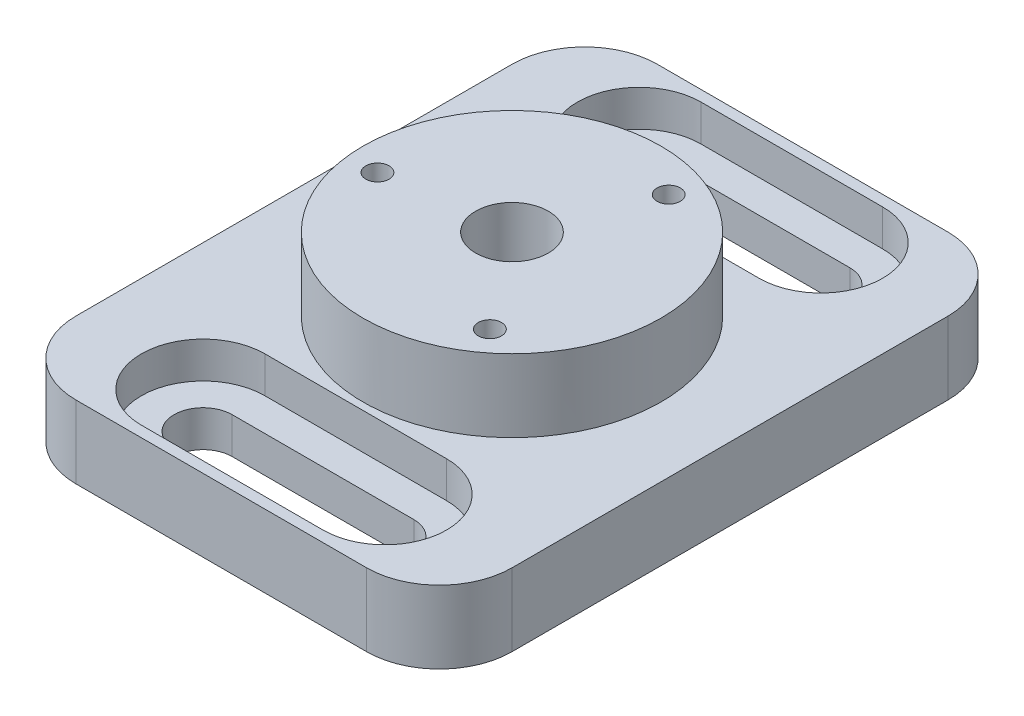
from build123d import *

# Parameters (mm, degrees)
SKETCH1_R           = 20.5
SKETCH1_R_2         = 1.6
SKETCH1_R_3         = 5
BOSS_EXTRUDE1_DEPTH = 20
SKETCH2_W           = 60
SKETCH2_H           = 80
SKETCH2_R           = 20.5
BOSS_EXTRUDE2_DEPTH = 10
CUT_EXTRUDE1_DEPTH  = 5
FILLET1_R           = 10
SKETCH4_R           = 5
CUT_EXTRUDE2_DEPTH  = 7


with BuildPart() as part:
    # Sketch1 → Boss-Extrude1 (new body)
    with BuildSketch(Plane(origin=(0, 0, 0), x_dir=(1, 0, 0), z_dir=(0, 1, 0))):
        with Locations(Location((0, 0, 0), (0, 0, 270))):
            Circle(SKETCH1_R)
        with Locations(Location((6.314276634, 15.244012286, 0), (0, 0, 270))):
            Circle(SKETCH1_R_2, mode=Mode.SUBTRACT)
        with Locations(Location((10.044563579, -13.090330115, 0), (0, 0, 270))):
            Circle(SKETCH1_R_2, mode=Mode.SUBTRACT)
        with Locations(Location((-16.358840213, -2.153682172, 0), (0, 0, 270))):
            Circle(SKETCH1_R_2, mode=Mode.SUBTRACT)
        with Locations(Location((0, 0, 0), (0, 0, 270))):
            Circle(SKETCH1_R_3, mode=Mode.SUBTRACT)
    extrude(amount=BOSS_EXTRUDE1_DEPTH)

    # Sketch2 → Boss-Extrude2 (add)
    with BuildSketch(Plane.XZ):
        Rectangle(SKETCH2_W, SKETCH2_H)
        with Locations(Location((0, 0, 0), (0, 0, 270))):
            Circle(SKETCH2_R, mode=Mode.SUBTRACT)
        with BuildLine():
            Line((-12.5, 34), (12.5, 34))
            ThreePointArc((12.5, 34), (16.5, 30), (12.5, 26))
            Line((12.5, 26), (-12.5, 26))
            ThreePointArc((-12.5, 26), (-16.5, 30), (-12.5, 34))
        make_face(mode=Mode.SUBTRACT)
        with BuildLine():
            Line((-12.5, -34), (12.5, -34))
            ThreePointArc((12.5, -34), (16.5, -30), (12.5, -26))
            Line((12.5, -26), (-12.5, -26))
            ThreePointArc((-12.5, -26), (-16.5, -30), (-12.5, -34))
        make_face(mode=Mode.SUBTRACT)
    extrude(amount=-BOSS_EXTRUDE2_DEPTH)

    # Sketch3 → Cut-Extrude1 (cut)
    with BuildSketch(Plane(origin=(0, 10, 0), x_dir=(1, 0, 0), z_dir=(0, 1, 0))):
        with BuildLine():
            Line((-12.5, 38.5), (12.5, 38.5))
            ThreePointArc((12.5, 38.5), (21, 30), (12.5, 21.5))
            Line((12.5, 21.5), (-12.5, 21.5))
            ThreePointArc((-12.5, 21.5), (-21, 30), (-12.5, 38.5))
        make_face()
        with BuildLine():
            Line((-12.5, -38.5), (12.5, -38.5))
            ThreePointArc((12.5, -38.5), (21, -30), (12.5, -21.5))
            Line((12.5, -21.5), (-12.5, -21.5))
            ThreePointArc((-12.5, -21.5), (-21, -30), (-12.5, -38.5))
        make_face()
    extrude(amount=-CUT_EXTRUDE1_DEPTH, mode=Mode.SUBTRACT)

    # Fillet1
    fillet1_edges = [part.edges().sort_by_distance(p)[0] for p in [
        (30, 5, 40),
        (30, 5, -40),
        (-30, 5, -40),
        (-30, 5, 40),
    ]]
    fillet(fillet1_edges, radius=FILLET1_R)

    # Sketch4 → Cut-Extrude2 (cut)
    with BuildSketch(Plane.XZ):
        with Locations(Location((10.044563579, 13.090330115, 0), (0, 0, 270))):
            Circle(SKETCH4_R)
        with Locations(Location((6.314276634, -15.244012286, 0), (0, 0, 270))):
            Circle(SKETCH4_R)
        with Locations(Location((-16.358840213, 2.153682172, 0), (0, 0, 270))):
            Circle(SKETCH4_R)
    extrude(amount=-CUT_EXTRUDE2_DEPTH, mode=Mode.SUBTRACT)


solid = part.part
